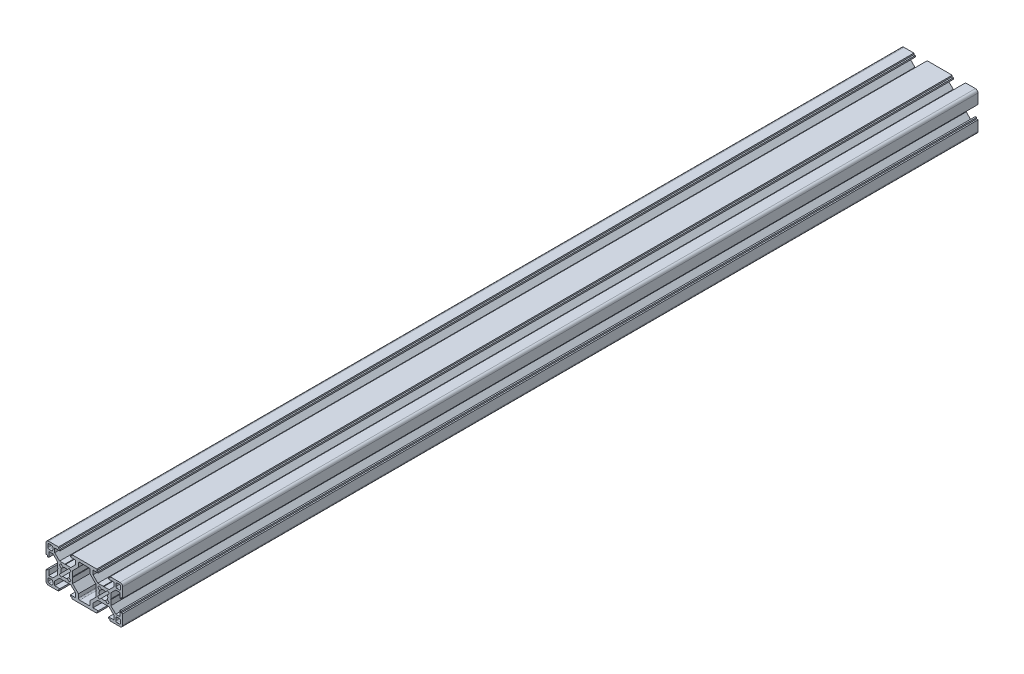
from build123d import *

# Parameters (mm, degrees)
BOSS_EXTRUDE1_DEPTH = 335


with BuildPart() as part:
    # Sketch1 → Boss-Extrude1 (new, symmetric)
    with BuildSketch(Plane.XY):
        with BuildLine():
            Line((-9.8, -15), (9.8, -15))
            Line((9.8, -15), (9.8, -13.9))
            Line((9.8, -13.9), (10.9, -13.9))
            Line((10.9, -13.9), (10.9, -12.8))
            Line((10.9, -12.8), (6.8, -12.8))
            Line((6.8, -12.8), (6.8, -9.614213562))
            Line((6.8, -9.614213562), (10.614213562, -5.8))
            Line((10.614213562, -5.8), (14.75, -5.8))
            Line((14.75, -5.8), (15, -5.55))
            Line((15, -5.55), (15.25, -5.8))
            Line((15.25, -5.8), (19.385786438, -5.8))
            Line((19.385786438, -5.8), (23.2, -9.614213562))
            Line((23.2, -9.614213562), (23.2, -12.8))
            Line((23.2, -12.8), (19.1, -12.8))
            Line((19.1, -12.8), (19.1, -13.9))
            Line((19.1, -13.9), (20.2, -13.9))
            Line((20.2, -13.9), (20.2, -15))
            Line((20.2, -15), (28, -15))
            ThreePointArc((28, -15), (29.414213562, -14.414213562), (30, -13))
            Line((30, -13), (30, -5.2))
            Line((30, -5.2), (28.9, -5.2))
            Line((28.9, -5.2), (28.9, -4.1))
            Line((28.9, -4.1), (27.8, -4.1))
            Line((27.8, -4.1), (27.8, -8.2))
            Line((27.8, -8.2), (24.614213562, -8.2))
            Line((24.614213562, -8.2), (20.8, -4.385786438))
            Line((20.8, -4.385786438), (20.8, -0.25))
            Line((20.8, -0.25), (20.55, 0))
            Line((20.55, 0), (20.8, 0.25))
            Line((20.8, 0.25), (20.8, 4.385786438))
            Line((20.8, 4.385786438), (24.614213562, 8.2))
            Line((24.614213562, 8.2), (27.8, 8.2))
            Line((27.8, 8.2), (27.8, 4.1))
            Line((27.8, 4.1), (28.9, 4.1))
            Line((28.9, 4.1), (28.9, 5.2))
            Line((28.9, 5.2), (30, 5.2))
            Line((30, 5.2), (30, 13))
            ThreePointArc((30, 13), (29.414213562, 14.414213562), (28, 15))
            Line((28, 15), (20.2, 15))
            Line((20.2, 15), (20.2, 13.9))
            Line((20.2, 13.9), (19.1, 13.9))
            Line((19.1, 13.9), (19.1, 12.8))
            Line((19.1, 12.8), (23.2, 12.8))
            Line((23.2, 12.8), (23.2, 9.614213562))
            Line((23.2, 9.614213562), (19.385786438, 5.8))
            Line((19.385786438, 5.8), (15.25, 5.8))
            Line((15.25, 5.8), (15, 5.55))
            Line((15, 5.55), (14.75, 5.8))
            Line((14.75, 5.8), (10.614213562, 5.8))
            Line((10.614213562, 5.8), (6.8, 9.614213562))
            Line((6.8, 9.614213562), (6.8, 12.8))
            Line((6.8, 12.8), (10.9, 12.8))
            Line((10.9, 12.8), (10.9, 13.9))
            Line((10.9, 13.9), (9.8, 13.9))
            Line((9.8, 13.9), (9.8, 15))
            Line((9.8, 15), (-9.8, 15))
            Line((-9.8, 15), (-9.8, 13.9))
            Line((-9.8, 13.9), (-10.9, 13.9))
            Line((-10.9, 13.9), (-10.9, 12.8))
            Line((-10.9, 12.8), (-6.8, 12.8))
            Line((-6.8, 12.8), (-6.8, 9.614213562))
            Line((-6.8, 9.614213562), (-10.614213562, 5.8))
            Line((-10.614213562, 5.8), (-14.75, 5.8))
            Line((-14.75, 5.8), (-15, 5.55))
            Line((-15, 5.55), (-15.25, 5.8))
            Line((-15.25, 5.8), (-19.385786438, 5.8))
            Line((-19.385786438, 5.8), (-23.2, 9.614213562))
            Line((-23.2, 9.614213562), (-23.2, 12.8))
            Line((-23.2, 12.8), (-19.1, 12.8))
            Line((-19.1, 12.8), (-19.1, 13.9))
            Line((-19.1, 13.9), (-20.2, 13.9))
            Line((-20.2, 13.9), (-20.2, 15))
            Line((-20.2, 15), (-28, 15))
            ThreePointArc((-28, 15), (-29.414213562, 14.414213562), (-30, 13))
            Line((-30, 13), (-30, 5.2))
            Line((-30, 5.2), (-28.9, 5.2))
            Line((-28.9, 5.2), (-28.9, 4.1))
            Line((-28.9, 4.1), (-27.8, 4.1))
            Line((-27.8, 4.1), (-27.8, 8.2))
            Line((-27.8, 8.2), (-24.614213562, 8.2))
            Line((-24.614213562, 8.2), (-20.8, 4.385786438))
            Line((-20.8, 4.385786438), (-20.8, 0.25))
            Line((-20.8, 0.25), (-20.55, 0))
            Line((-20.55, 0), (-20.8, -0.25))
            Line((-20.8, -0.25), (-20.8, -4.385786438))
            Line((-20.8, -4.385786438), (-24.614213562, -8.2))
            Line((-24.614213562, -8.2), (-27.8, -8.2))
            Line((-27.8, -8.2), (-27.8, -4.1))
            Line((-27.8, -4.1), (-28.9, -4.1))
            Line((-28.9, -4.1), (-28.9, -5.2))
            Line((-28.9, -5.2), (-30, -5.2))
            Line((-30, -5.2), (-30, -13))
            ThreePointArc((-30, -13), (-29.414213562, -14.414213562), (-28, -15))
            Line((-28, -15), (-20.2, -15))
            Line((-20.2, -15), (-20.2, -13.9))
            Line((-20.2, -13.9), (-19.1, -13.9))
            Line((-19.1, -13.9), (-19.1, -12.8))
            Line((-19.1, -12.8), (-23.2, -12.8))
            Line((-23.2, -12.8), (-23.2, -9.614213562))
            Line((-23.2, -9.614213562), (-19.385786438, -5.8))
            Line((-19.385786438, -5.8), (-15.25, -5.8))
            Line((-15.25, -5.8), (-15, -5.55))
            Line((-15, -5.55), (-14.75, -5.8))
            Line((-14.75, -5.8), (-10.614213562, -5.8))
            Line((-10.614213562, -5.8), (-6.8, -9.614213562))
            Line((-6.8, -9.614213562), (-6.8, -12.8))
            Line((-6.8, -12.8), (-10.9, -12.8))
            Line((-10.9, -12.8), (-10.9, -13.9))
            Line((-10.9, -13.9), (-9.8, -13.9))
            Line((-9.8, -13.9), (-9.8, -15))
        make_face()
        with BuildLine():
            Line((-28.5, 10.7), (-28.5, 12.5))
            ThreePointArc((-28.5, 12.5), (-28.207106781, 13.207106781), (-27.5, 13.5))
            Line((-27.5, 13.5), (-25.7, 13.5))
            ThreePointArc((-25.7, 13.5), (-24.992893219, 13.207106781), (-24.7, 12.5))
            Line((-24.7, 12.5), (-24.7, 10.7))
            ThreePointArc((-24.7, 10.7), (-24.992893219, 9.992893219), (-25.7, 9.7))
            Line((-25.7, 9.7), (-27.5, 9.7))
            ThreePointArc((-27.5, 9.7), (-28.207106781, 9.992893219), (-28.5, 10.7))
        make_face(mode=Mode.SUBTRACT)
        with BuildLine():
            Line((-11.99506816, -1.590718277), (-10.404077903, -3.181708535))
            Line((-10.404077903, -3.181708535), (-11.818291465, -4.595922097))
            Line((-11.818291465, -4.595922097), (-13.409281723, -3.00493184))
            ThreePointArc((-13.409281723, -3.00493184), (-15, -3.4), (-16.590718277, -3.00493184))
            Line((-16.590718277, -3.00493184), (-18.181708535, -4.595922097))
            Line((-18.181708535, -4.595922097), (-19.595922097, -3.181708535))
            Line((-19.595922097, -3.181708535), (-18.00493184, -1.590718277))
            ThreePointArc((-18.00493184, -1.590718277), (-18.4, 0), (-18.00493184, 1.590718277))
            Line((-18.00493184, 1.590718277), (-19.595922097, 3.181708535))
            Line((-19.595922097, 3.181708535), (-18.181708535, 4.595922097))
            Line((-18.181708535, 4.595922097), (-16.590718277, 3.00493184))
            ThreePointArc((-16.590718277, 3.00493184), (-15, 3.4), (-13.409281723, 3.00493184))
            Line((-13.409281723, 3.00493184), (-11.818291465, 4.595922097))
            Line((-11.818291465, 4.595922097), (-10.404077903, 3.181708535))
            Line((-10.404077903, 3.181708535), (-11.99506816, 1.590718277))
            ThreePointArc((-11.99506816, 1.590718277), (-11.6, 0), (-11.99506816, -1.590718277))
        make_face(mode=Mode.SUBTRACT)
        with BuildLine():
            Line((-28.5, -12.5), (-28.5, -10.7))
            ThreePointArc((-28.5, -10.7), (-28.207106781, -9.992893219), (-27.5, -9.7))
            Line((-27.5, -9.7), (-25.7, -9.7))
            ThreePointArc((-25.7, -9.7), (-24.992893219, -9.992893219), (-24.7, -10.7))
            Line((-24.7, -10.7), (-24.7, -12.5))
            ThreePointArc((-24.7, -12.5), (-24.992893219, -13.207106781), (-25.7, -13.5))
            Line((-25.7, -13.5), (-27.5, -13.5))
            ThreePointArc((-27.5, -13.5), (-28.207106781, -13.207106781), (-28.5, -12.5))
        make_face(mode=Mode.SUBTRACT)
        with BuildLine():
            Line((28.5, -10.7), (28.5, -12.5))
            ThreePointArc((28.5, -12.5), (28.207106781, -13.207106781), (27.5, -13.5))
            Line((27.5, -13.5), (25.7, -13.5))
            ThreePointArc((25.7, -13.5), (24.992893219, -13.207106781), (24.7, -12.5))
            Line((24.7, -12.5), (24.7, -10.7))
            ThreePointArc((24.7, -10.7), (24.992893219, -9.992893219), (25.7, -9.7))
            Line((25.7, -9.7), (27.5, -9.7))
            ThreePointArc((27.5, -9.7), (28.207106781, -9.992893219), (28.5, -10.7))
        make_face(mode=Mode.SUBTRACT)
        with BuildLine():
            Line((11.99506816, 1.590718277), (10.404077903, 3.181708535))
            Line((10.404077903, 3.181708535), (11.818291465, 4.595922097))
            Line((11.818291465, 4.595922097), (13.409281723, 3.00493184))
            ThreePointArc((13.409281723, 3.00493184), (15, 3.4), (16.590718277, 3.00493184))
            Line((16.590718277, 3.00493184), (18.181708535, 4.595922097))
            Line((18.181708535, 4.595922097), (19.595922097, 3.181708535))
            Line((19.595922097, 3.181708535), (18.00493184, 1.590718277))
            ThreePointArc((18.00493184, 1.590718277), (18.4, 0), (18.00493184, -1.590718277))
            Line((18.00493184, -1.590718277), (19.595922097, -3.181708535))
            Line((19.595922097, -3.181708535), (18.181708535, -4.595922097))
            Line((18.181708535, -4.595922097), (16.590718277, -3.00493184))
            ThreePointArc((16.590718277, -3.00493184), (15, -3.4), (13.409281723, -3.00493184))
            Line((13.409281723, -3.00493184), (11.818291465, -4.595922097))
            Line((11.818291465, -4.595922097), (10.404077903, -3.181708535))
            Line((10.404077903, -3.181708535), (11.99506816, -1.590718277))
            ThreePointArc((11.99506816, -1.590718277), (11.6, 0), (11.99506816, 1.590718277))
        make_face(mode=Mode.SUBTRACT)
        with BuildLine():
            Line((28.5, 12.5), (28.5, 10.7))
            ThreePointArc((28.5, 10.7), (28.207106781, 9.992893219), (27.5, 9.7))
            Line((27.5, 9.7), (25.7, 9.7))
            ThreePointArc((25.7, 9.7), (24.992893219, 9.992893219), (24.7, 10.7))
            Line((24.7, 10.7), (24.7, 12.5))
            ThreePointArc((24.7, 12.5), (24.992893219, 13.207106781), (25.7, 13.5))
            Line((25.7, 13.5), (27.5, 13.5))
            ThreePointArc((27.5, 13.5), (28.207106781, 13.207106781), (28.5, 12.5))
        make_face(mode=Mode.SUBTRACT)
        with BuildLine():
            Line((3.6, -12.8), (-3.6, -12.8))
            ThreePointArc((-3.6, -12.8), (-4.307106781, -12.507106781), (-4.6, -11.8))
            Line((-4.6, -11.8), (-4.6, -8.985786438))
            Line((-4.6, -8.985786438), (-9.2, -4.385786438))
            Line((-9.2, -4.385786438), (-9.2, -0.25))
            Line((-9.2, -0.25), (-9.45, 0))
            Line((-9.45, 0), (-9.2, 0.25))
            Line((-9.2, 0.25), (-9.2, 4.385786438))
            Line((-9.2, 4.385786438), (-4.6, 8.985786438))
            Line((-4.6, 8.985786438), (-4.6, 11.8))
            ThreePointArc((-4.6, 11.8), (-4.307106781, 12.507106781), (-3.6, 12.8))
            Line((-3.6, 12.8), (3.6, 12.8))
            ThreePointArc((3.6, 12.8), (4.307106781, 12.507106781), (4.6, 11.8))
            Line((4.6, 11.8), (4.6, 8.985786438))
            Line((4.6, 8.985786438), (9.2, 4.385786438))
            Line((9.2, 4.385786438), (9.2, 0.25))
            Line((9.2, 0.25), (9.45, 0))
            Line((9.45, 0), (9.2, -0.25))
            Line((9.2, -0.25), (9.2, -4.385786438))
            Line((9.2, -4.385786438), (4.6, -8.985786438))
            Line((4.6, -8.985786438), (4.6, -11.8))
            ThreePointArc((4.6, -11.8), (4.307106781, -12.507106781), (3.6, -12.8))
        make_face(mode=Mode.SUBTRACT)
    extrude(amount=BOSS_EXTRUDE1_DEPTH, both=True)


solid = part.part
